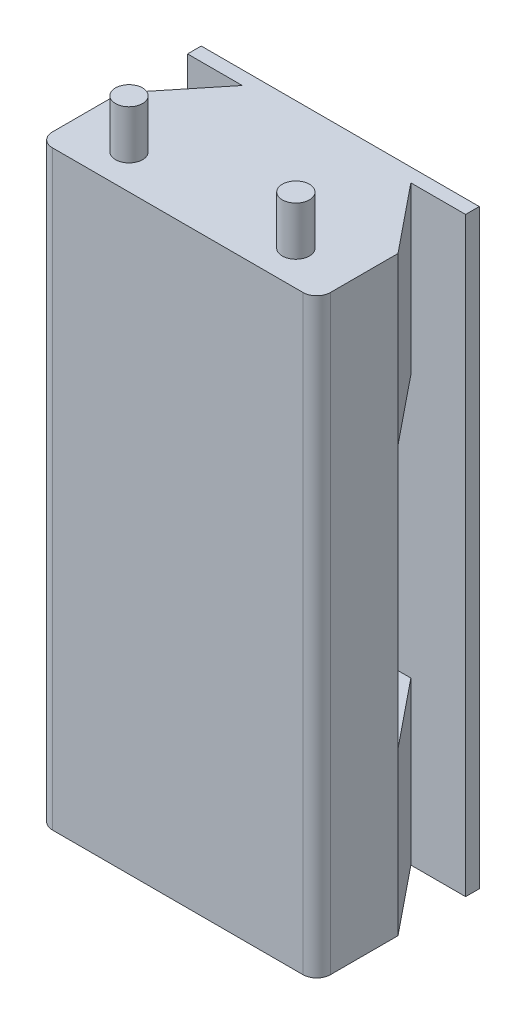
from build123d import *

# Parameters (mm, degrees)
SKETCH1_W           = 101.6
SKETCH1_H           = 25.4
BOSS_EXTRUDE1_DEPTH = 215.9
SKETCH3_R           = 5.207
CUT_EXTRUDE1_DEPTH  = 17.78
SKETCH4_R           = 4.953
BOSS_EXTRUDE3_DEPTH = 17.78
SKETCH8_W           = 101.6
SKETCH8_H           = 215.9
BOSS_EXTRUDE4_DEPTH = 34
CUT_EXTRUDE2_DEPTH  = 217
SKETCH14_R          = 3.5
CUT_EXTRUDE3_DEPTH  = 9
FILLET1_R           = 5
FILLET2_R           = 5
SKETCH16_W          = 24.7
SKETCH16_H          = 96
CUT_EXTRUDE4_DEPTH  = 42
SKETCH17_W          = 24.7
SKETCH17_H          = 96
CUT_EXTRUDE5_DEPTH  = 42


with BuildPart() as part:
    # Sketch1 → Boss-Extrude1 (new body)
    with BuildSketch(Plane(origin=(0, 0, 0), x_dir=(1, 0, 0), z_dir=(0, 1, 0))):
        with Locations((25.4, 12.7)):
            Rectangle(SKETCH1_W, SKETCH1_H)
    extrude(amount=BOSS_EXTRUDE1_DEPTH)

    # Sketch3 → Cut-Extrude1 (cut)
    with BuildSketch(Plane(origin=(0, 0, 0), x_dir=(-1, 0, 0), z_dir=(0, -1, 0))):
        with Locations(Location((5.08, 12.7, 0), (0, 0, 90))):
            Circle(SKETCH3_R)
        with Locations(Location((-55.88, 12.7, 0), (0, 0, 90))):
            Circle(SKETCH3_R)
    extrude(amount=-CUT_EXTRUDE1_DEPTH, mode=Mode.SUBTRACT)

    # Sketch4 → Boss-Extrude3 (add)
    with BuildSketch(Plane(origin=(0, 215.9, 0), x_dir=(1, 0, 0), z_dir=(0, 1, 0))):
        with Locations(Location((-5.08, 12.7, 0), (0, 0, 270))):
            Circle(SKETCH4_R)
        with Locations(Location((55.88, 12.7, 0), (0, 0, 270))):
            Circle(SKETCH4_R)
    extrude(amount=BOSS_EXTRUDE3_DEPTH)

    # Sketch8 → Boss-Extrude4 (add)
    with BuildSketch(Plane(origin=(0, 0, -25.4), x_dir=(-1, 0, 0), z_dir=(0, 0, -1))):
        with Locations((-25.4, 107.95)):
            Rectangle(SKETCH8_W, SKETCH8_H)
    extrude(amount=BOSS_EXTRUDE4_DEPTH)

    # Sketch10 → Cut-Extrude2 (cut)
    with BuildSketch(Plane(origin=(0, 215.9, 0), x_dir=(1, 0, 0), z_dir=(0, 1, 0))):
        Polygon((-25.4, 54.4), (-5.4, 54.4), (-25.4, 29.7), align=None)
        Polygon((76.2, 54.4), (56.2, 54.4), (76.2, 29.7), align=None)
    extrude(amount=-CUT_EXTRUDE2_DEPTH, mode=Mode.SUBTRACT)

    # Sketch14 → Cut-Extrude3 (cut)
    with BuildSketch(Plane(origin=(0, 0, -59.4), x_dir=(-1, 0, 0), z_dir=(0, 0, -1))):
        with Locations((-41.400000283, 129.695762338)):
            Circle(SKETCH14_R)
        with Locations((-9.400000283, 129.695762338)):
            Circle(SKETCH14_R)
        with Locations((-41.400000283, 93.695762338)):
            Circle(SKETCH14_R)
        with Locations((-9.400000283, 93.695762338)):
            Circle(SKETCH14_R)
    extrude(amount=-CUT_EXTRUDE3_DEPTH, mode=Mode.SUBTRACT)

    # Fillet1
    fillet1_edges = [part.edges().sort_by_distance(p)[0] for p in [
        (-25.4, 107.95, 0),
    ]]
    fillet(fillet1_edges, radius=FILLET1_R)

    # Fillet2
    fillet2_edges = [part.edges().sort_by_distance(p)[0] for p in [
        (76.2, 107.95, 0),
    ]]
    fillet(fillet2_edges, radius=FILLET2_R)

    # Sketch16 → Cut-Extrude4 (cut)
    with BuildSketch(Plane.ZY.offset(25.4)):
        with Locations((-42.05, 110.012919034)):
            Rectangle(SKETCH16_W, SKETCH16_H)
    extrude(amount=-CUT_EXTRUDE4_DEPTH, mode=Mode.SUBTRACT)

    # Sketch17 → Cut-Extrude5 (cut)
    with BuildSketch(Plane(origin=(76.2, 0, 0), x_dir=(0, 0, -1), z_dir=(1, 0, 0))):
        with Locations((42.05, 107.199291506)):
            Rectangle(SKETCH17_W, SKETCH17_H)
    extrude(amount=-CUT_EXTRUDE5_DEPTH, mode=Mode.SUBTRACT)


solid = part.part
